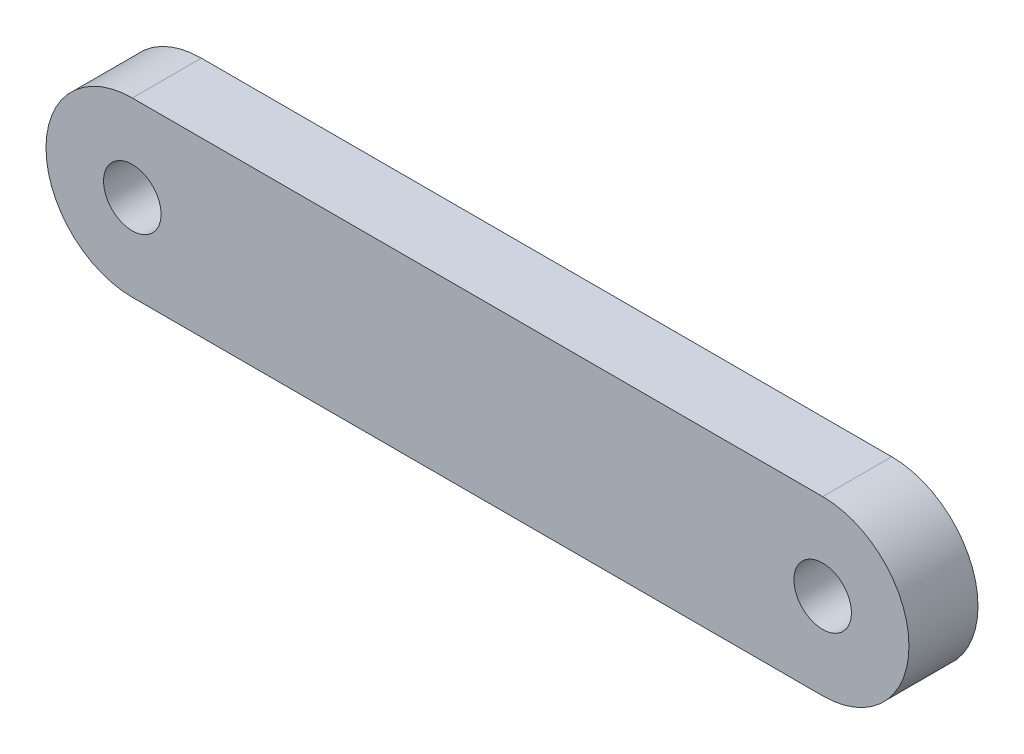
from build123d import *

# Parameters (mm, degrees)
SKETCH1_R           = 2.5
BOSS_EXTRUDE1_DEPTH = 3


with BuildPart() as part:
    # Sketch1 → Boss-Extrude1 (new, symmetric)
    with BuildSketch(Plane.XY):
        with BuildLine():
            Line((-30, 7.5), (30, 7.5))
            ThreePointArc((30, 7.5), (37.5, 0), (30, -7.5))
            Line((30, -7.5), (-30, -7.5))
            ThreePointArc((-30, -7.5), (-37.5, 0), (-30, 7.5))
        make_face()
        with Locations((-30, 0)):
            Circle(SKETCH1_R, mode=Mode.SUBTRACT)
        with Locations((30, 0)):
            Circle(SKETCH1_R, mode=Mode.SUBTRACT)
    extrude(amount=BOSS_EXTRUDE1_DEPTH, both=True)


solid = part.part
